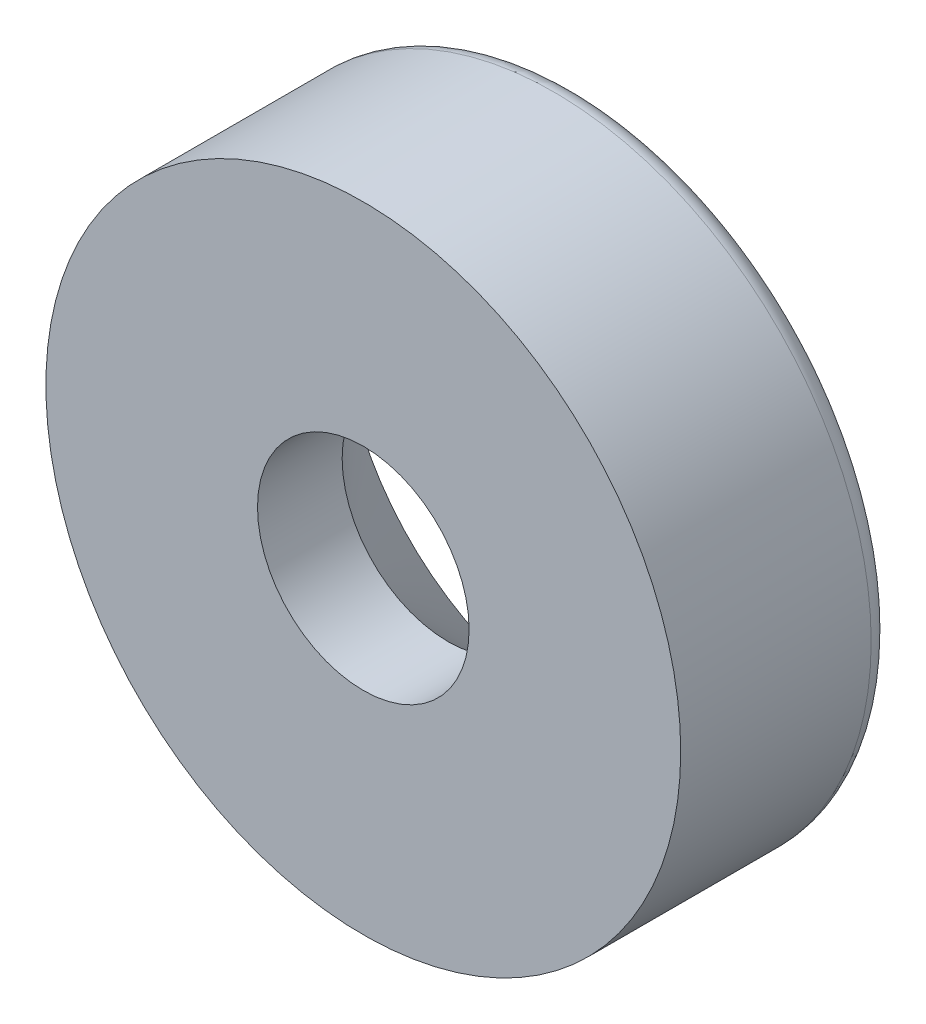
from build123d import *

# Parameters (mm, degrees)
SKETCH_1_R      = 3
SKETCH_1_R_2    = 1
EXTRUDE_1_DEPTH = 2
CHAMFER_1_SIZE  = 1.2
FILLET_1_R      = 0.2


with BuildPart() as part:
    # 草图1 → 凸台-拉伸1 (new body)
    with BuildSketch(Plane.XY):
        Circle(SKETCH_1_R)
        Circle(SKETCH_1_R_2, mode=Mode.SUBTRACT)
    extrude(amount=EXTRUDE_1_DEPTH)

    # 倒角1
    chamfer_1_edges = [part.edges().sort_by_distance(p)[0] for p in [
        (-1, 0, 0),
    ]]
    chamfer(chamfer_1_edges, length=CHAMFER_1_SIZE)

    # 圆角1
    fillet_1_edges = [part.edges().sort_by_distance(p)[0] for p in [
        (-3, 0, 0),
    ]]
    fillet(fillet_1_edges, radius=FILLET_1_R)


solid = part.part
